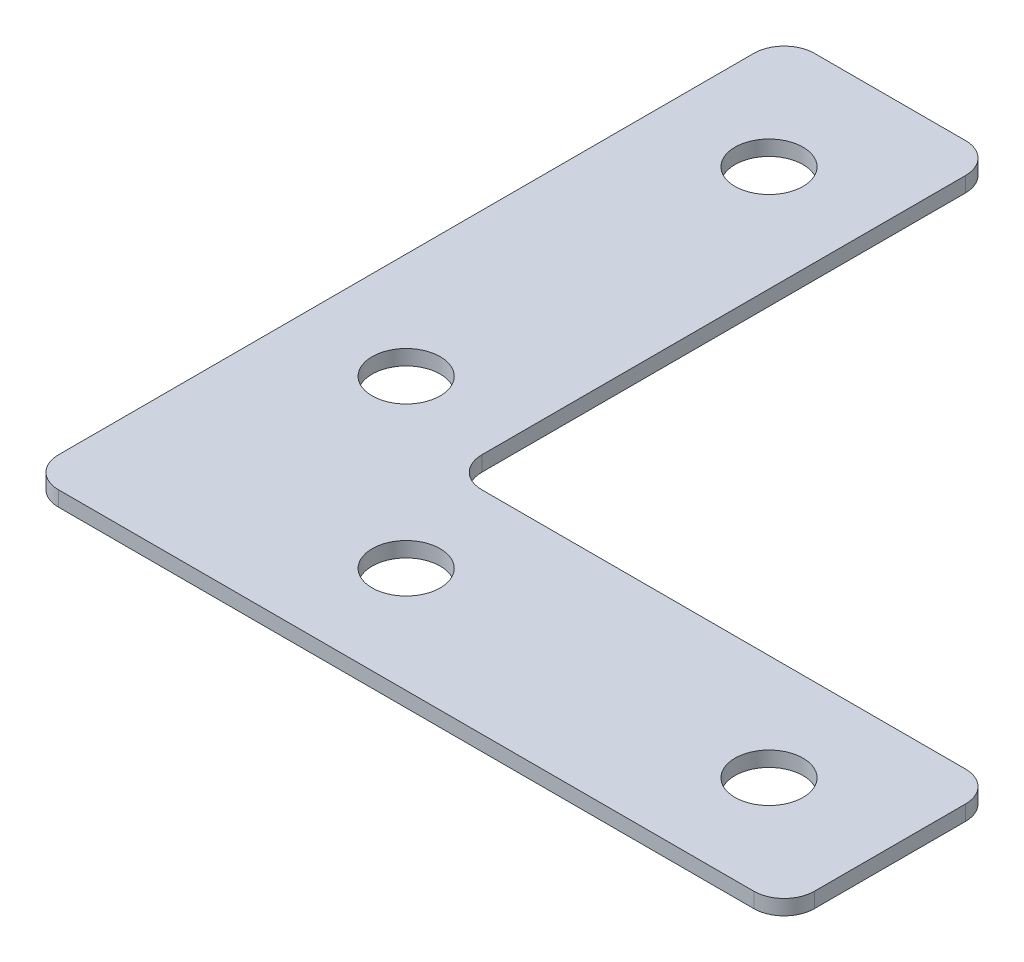
from build123d import *

# Parameters (mm, degrees)
SKETCH_1_R      = 2.25
EXTRUDE_2_DEPTH = 1


with BuildPart() as part:
    # 草图1 → 凸台-拉伸2 (new body)
    with BuildSketch(Plane(origin=(0, 0, 0), x_dir=(1, 0, 0), z_dir=(0, 1, 0))):
        with BuildLine():
            Line((2, 50), (12, 50))
            ThreePointArc((12, 50), (13.414213562, 49.414213562), (14, 48))
            Line((14, 48), (14, 16))
            ThreePointArc((14, 16), (14.585786438, 14.585786438), (16, 14))
            Line((16, 14), (48, 14))
            ThreePointArc((48, 14), (49.414213562, 13.414213562), (50, 12))
            Line((50, 12), (50, 2))
            ThreePointArc((50, 2), (49.414213562, 0.585786438), (48, 0))
            Line((48, 0), (2, 0))
            ThreePointArc((2, 0), (0.585786438, 0.585786438), (0, 2))
            Line((0, 2), (0, 48))
            ThreePointArc((0, 48), (0.585786438, 49.414213562), (2, 50))
        make_face()
        with Locations(Location((18, 7, 0), (0, 0, 270))):
            Circle(SKETCH_1_R, mode=Mode.SUBTRACT)
        with Locations(Location((42, 7, 0), (0, 0, 270))):
            Circle(SKETCH_1_R, mode=Mode.SUBTRACT)
        with Locations(Location((7, 18, 0), (0, 0, 270))):
            Circle(SKETCH_1_R, mode=Mode.SUBTRACT)
        with Locations(Location((7, 42, 0), (0, 0, 270))):
            Circle(SKETCH_1_R, mode=Mode.SUBTRACT)
    extrude(amount=EXTRUDE_2_DEPTH)


solid = part.part
